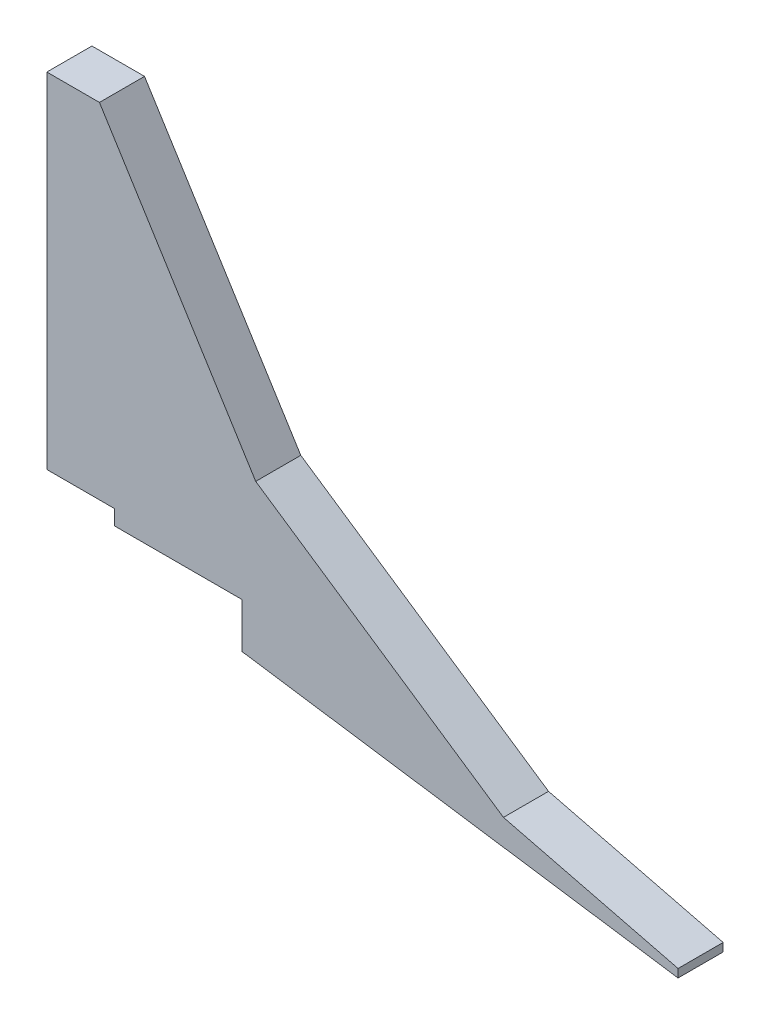
from build123d import *

# Parameters (mm, degrees)
SEAT_AGAINST_SCOOP_AND_FLOOR_DEPTH = 3


with BuildPart() as part:
    # Seat against scoop and floor profile → Seat against scoop and floor (new body)
    with BuildSketch(Plane.XY):
        Polygon((94.5, 10), (103, 10), (103, 7), (132, 2.7), (132, 3.249), (120.380483, 6.145775), (103.896885, 17.264102), (93.5, 33.9026), (90, 33.9026), (90, 11), (94.5, 11), align=None)
    extrude(amount=SEAT_AGAINST_SCOOP_AND_FLOOR_DEPTH)


solid = part.part
